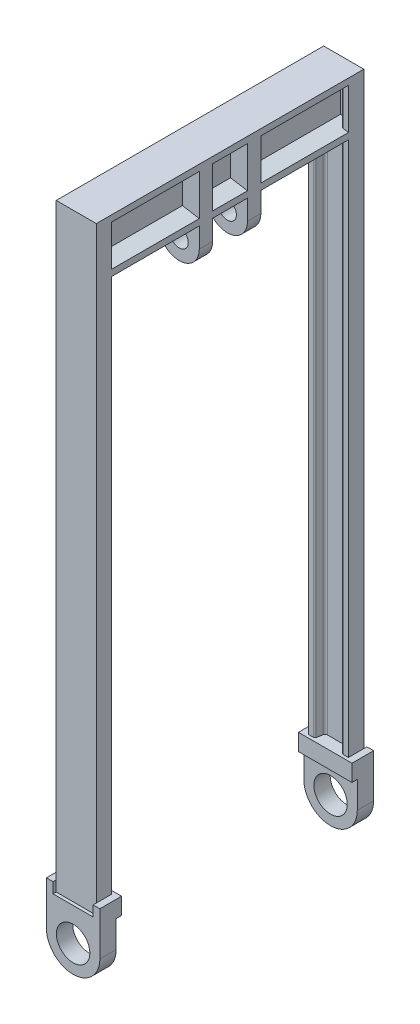
from build123d import *

# Parameters (mm, degrees)
BOSS_EXTRUDE1_DEPTH      = 57.15
BOSS_EXTRUDE1_2_DEPTH    = 57.15
BOSS_EXTRUDE2_DEPTH      = 50.8
BOSS_EXTRUDE3_DEPTH      = 0.6
BOSS_EXTRUDE3_DEPTH_BACK = 3.521
SKETCH3_R                = 3.175
SKETCH4_W                = 1.016
SKETCH4_H                = 10.16
CUT_EXTRUDE1_DEPTH       = 74.455759645
SKETCH5_W                = 7.62
SKETCH5_H                = 2
CUT_EXTRUDE2_DEPTH       = 85.988054602
BOSS_EXTRUDE6_DEPTH      = 0.6
BOSS_EXTRUDE6_DEPTH_BACK = 3.521
SKETCH6_R                = 3.175
BOSS_EXTRUDE7_START      = 3.302
SKETCH7_R                = 1.7145
BOSS_EXTRUDE7_DEPTH      = 2.54
SKETCH8_W                = 2.54
SKETCH8_H                = 7.76
BOSS_EXTRUDE8_DEPTH      = 7.62


with BuildPart() as part:
    # Sketch1 → Boss-Extrude1 (new, symmetric)
    with BuildSketch(Plane(origin=(0, 0, 0), x_dir=(1, 0, 0), z_dir=(0, 1, 0))):
        with BuildLine():
            Line((-3.81, 25.4), (-3.81, 22.479))
            Line((-3.81, 22.479), (-2.794, 22.479))
            ThreePointArc((-2.794, 22.479), (-2.630731947, 22.538424711), (-2.543858831, 22.688893363))
            Line((-2.543858831, 22.688893363), (-2.352506152, 23.774108332))
            ThreePointArc((-2.352506152, 23.774108332), (-2.178759919, 24.075045635), (-1.852223813, 24.193895058))
            Line((-1.852223813, 24.193895058), (1.852223813, 24.193895058))
            ThreePointArc((1.852223813, 24.193895058), (2.178759919, 24.075045635), (2.352506152, 23.774108332))
            Line((2.352506152, 23.774108332), (2.543858831, 22.688893363))
            ThreePointArc((2.543858831, 22.688893363), (2.630731947, 22.538424711), (2.794, 22.479))
            Line((2.794, 22.479), (3.81, 22.479))
            Line((3.81, 22.479), (3.81, 25.4))
            Line((3.81, 25.4), (-3.81, 25.4))
        make_face()
    extrude(amount=BOSS_EXTRUDE1_DEPTH, both=True)



with BuildPart() as body_2:
    # Sketch1 → Boss-Extrude1 2 (new, symmetric)
    with BuildSketch(Plane(origin=(0, 0, 0), x_dir=(1, 0, 0), z_dir=(0, 1, 0))):
        with BuildLine():
            Line((-2.278486426, -24.193895058), (-2.543858831, -22.688893363))
            ThreePointArc((-2.543858831, -22.688893363), (-2.630731947, -22.538424711), (-2.794, -22.479))
            Line((-2.794, -22.479), (-3.81, -22.479))
            Line((-3.81, -22.479), (-3.81, -25.4))
            Line((-3.81, -25.4), (3.81, -25.4))
            Line((3.81, -25.4), (3.81, -22.479))
            Line((3.81, -22.479), (2.794, -22.479))
            ThreePointArc((2.794, -22.479), (2.630731947, -22.538424711), (2.543858831, -22.688893363))
            Line((2.543858831, -22.688893363), (2.278486426, -24.193895058))
            ThreePointArc((2.278486426, -24.193895058), (2.070186355, -24.241918271), (1.860572408, -24.2))
            Line((1.860572408, -24.2), (-2.146199428, -24.2))
            ThreePointArc((-2.146199428, -24.2), (-2.212542712, -24.201276643), (-2.278486426, -24.193895058))
        make_face()
    extrude(amount=BOSS_EXTRUDE1_2_DEPTH, both=True)


with BuildPart() as part_1:
    add(part.part)

    add(body_2.part)  # Boss-Extrude2 merges body 2
    # Sketch2 → Boss-Extrude2 (add)
    with BuildSketch(Plane.XY.offset(25.4)):
        Polygon((-3.81, 57.15), (3.81, 57.15), (3.81, 55.95), (0.6, 55.412830225), (0.6, 48.727169775), (3.81, 48.19), (3.81, 46.99), (-3.81, 46.99), (-3.81, 48.19), (-0.6, 48.727169775), (-0.6, 55.412830225), (-3.81, 55.95), align=None)
    extrude(amount=-BOSS_EXTRUDE2_DEPTH)

    # Sketch3 → Boss-Extrude3 (add, two sides: drawn at the far end of the back side and taken through both)
    with BuildSketch(Plane.XY.offset(25.4).offset(-BOSS_EXTRUDE3_DEPTH_BACK)):
        with BuildLine():
            Line((-5.08, -54.61), (5.08, -54.61))
            Line((5.08, -54.61), (5.08, -62.865))
            ThreePointArc((5.08, -62.865), (0, -67.945), (-5.08, -62.865))
            Line((-5.08, -62.865), (-5.08, -54.61))
        make_face()
        with Locations((0, -62.865)):
            Circle(SKETCH3_R, mode=Mode.SUBTRACT)
    extrude(amount=BOSS_EXTRUDE3_DEPTH + BOSS_EXTRUDE3_DEPTH_BACK)

    # Sketch4 → Cut-Extrude1 (cut, through all)
    with BuildSketch(Plane.ZY.offset(5.08)):
        with Locations((22.387, -62.865)):
            Rectangle(SKETCH4_W, SKETCH4_H)
    cut_extrude1 = extrude(amount=-CUT_EXTRUDE1_DEPTH, mode=Mode.SUBTRACT)

    # Sketch5 → Cut-Extrude2 (cut, through all)
    with BuildSketch(Plane.XY.offset(25.4)):
        with Locations((0, -55.61)):
            Rectangle(SKETCH5_W, SKETCH5_H)
    cut_extrude2 = extrude(amount=CUT_EXTRUDE2_DEPTH, mode=Mode.SUBTRACT)

    # Sketch6 → Boss-Extrude6 (add, two sides: drawn at the far end of the back side and taken through both)
    with BuildSketch(Plane(origin=(0, 0, -25.4), x_dir=(-1, 0, 0), z_dir=(0, 0, -1)).offset(-BOSS_EXTRUDE6_DEPTH_BACK)):
        with BuildLine():
            Line((-5.08, -54.61), (5.08, -54.61))
            Line((5.08, -54.61), (5.08, -62.865))
            ThreePointArc((5.08, -62.865), (0, -67.945), (-5.08, -62.865))
            Line((-5.08, -62.865), (-5.08, -54.61))
        make_face()
        with Locations(Location((0, -62.865, 0), (0, 0, 180))):
            Circle(SKETCH6_R, mode=Mode.SUBTRACT)
    extrude(amount=BOSS_EXTRUDE6_DEPTH + BOSS_EXTRUDE6_DEPTH_BACK)

    # Mirror5: Cut-Extrude1 across plane
    add(cut_extrude1.mirror(Plane.XY), mode=Mode.SUBTRACT)

    # Mirror6: Cut-Extrude2 across plane
    add(cut_extrude2.mirror(Plane.XY), mode=Mode.SUBTRACT)

    # Sketch7 → Boss-Extrude7 (add)
    with BuildSketch(Plane.XY.offset(BOSS_EXTRUDE7_START)):
        with BuildLine():
            Line((3.81, 43.18), (3.81, 46.99))
            Line((3.81, 46.99), (-3.81, 46.99))
            Line((-3.81, 46.99), (-3.81, 43.18))
            ThreePointArc((-3.81, 43.18), (0, 39.37), (3.81, 43.18))
        make_face()
        with Locations((0, 43.18)):
            Circle(SKETCH7_R, mode=Mode.SUBTRACT)
    boss_extrude7 = extrude(amount=BOSS_EXTRUDE7_DEPTH)

    # Mirror7: Boss-Extrude7 across plane
    add(boss_extrude7.mirror(Plane.XY))

    # Sketch8 → Boss-Extrude8 (add)
    with BuildSketch(Plane.ZY.offset(3.81)):
        with Locations((4.572, 52.07)):
            Rectangle(SKETCH8_W, SKETCH8_H)
    boss_extrude8 = extrude(amount=-BOSS_EXTRUDE8_DEPTH)

    # Mirror8: Boss-Extrude8 across plane
    add(boss_extrude8.mirror(Plane.XY))


solid = part_1.part
